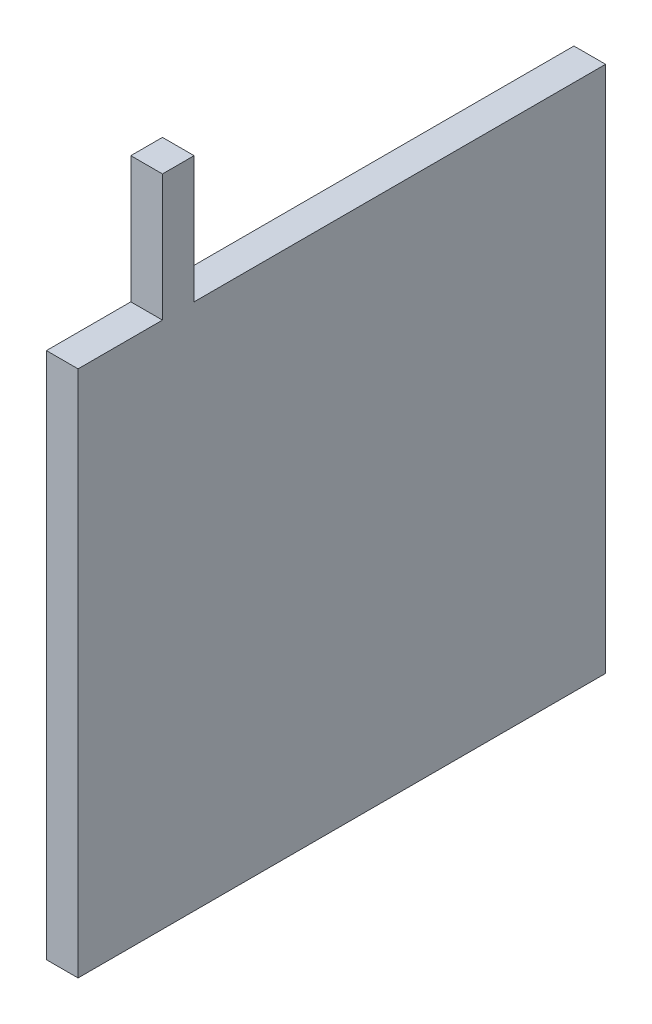
from build123d import *

# Parameters (mm, degrees)
BOSS_EXTRUDE1_DEPTH = 3


with BuildPart() as part:
    # Sketch1 → Boss-Extrude1 (new body)
    with BuildSketch(Plane(origin=(0, 0, 0), x_dir=(0, 0, -1), z_dir=(1, 0, 0))):
        Polygon((0, 0), (0, -12), (-8, -12), (-8, -62), (42, -62), (42, -12), (3, -12), (3, 0), align=None)
    extrude(amount=BOSS_EXTRUDE1_DEPTH)


solid = part.part
